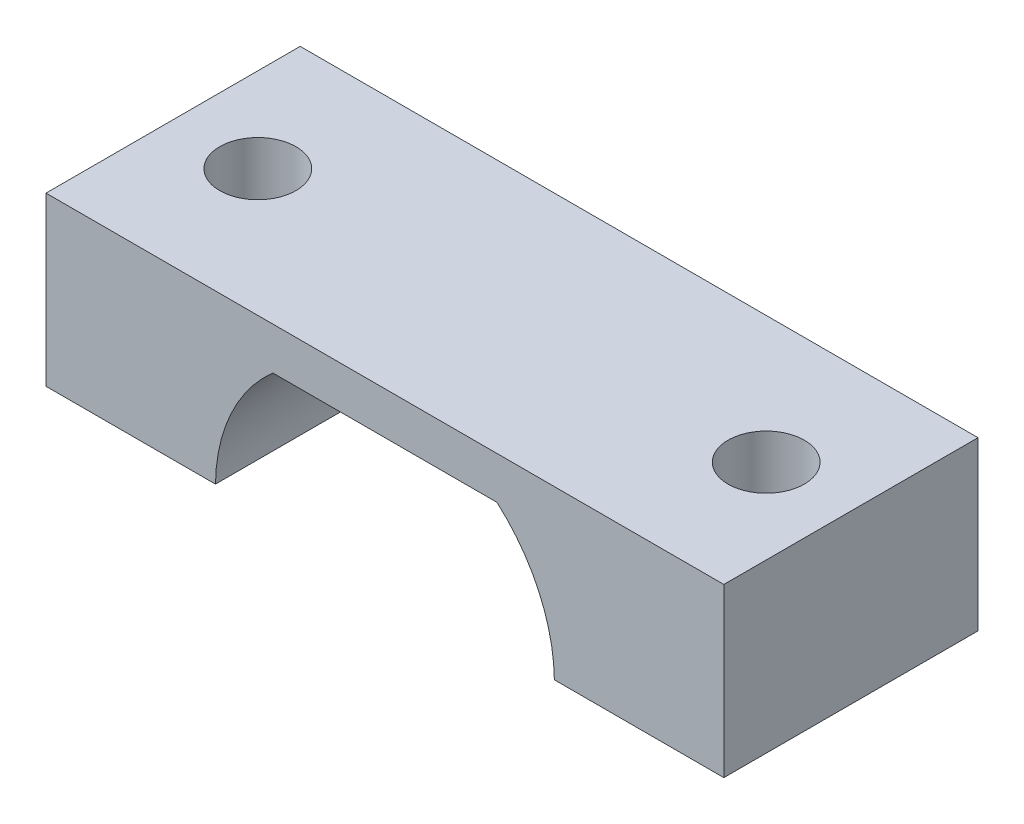
from build123d import *

# Parameters (mm, degrees)
MOTOR_CLAMP_OUTLINE_SOLID_DEPTH     = 7.5
MOTOR_CLAMP_MOUNTING_HOLES_SKETCH_R = 2.25
MOTOR_CLAMP_MOUNTING_HOLE_CUT_DEPTH = 24.532225245


with BuildPart() as part:
    # Motor Clamp Outline Sketch → Motor Clamp Outline Solid (new, symmetric)
    with BuildSketch(Plane.XY):
        with BuildLine():
            Line((-20, 0.125), (-9.999218719, 0.125))
            ThreePointArc((-9.999218719, 0.125), (-9.088484887, 4.171263892), (-6.614378278, 7.5))
            Line((-6.614378278, 7.5), (6.614378278, 7.5))
            ThreePointArc((6.614378278, 7.5), (9.088484887, 4.171263892), (9.999218719, 0.125))
            Line((9.999218719, 0.125), (20, 0.125))
            Line((20, 0.125), (20, 10))
            Line((20, 10), (-20, 10))
            Line((-20, 10), (-20, 0.125))
        make_face()
    extrude(amount=MOTOR_CLAMP_OUTLINE_SOLID_DEPTH, both=True)

    # Motor Clamp Mounting Holes Sketch → Motor Clamp Mounting Hole Cut (cut, through all)
    with BuildSketch(Plane(origin=(0, 10, 0), x_dir=(1, 0, 0), z_dir=(0, 1, 0))):
        with Locations(Location((-15, 0, 0), (0, 0, 270))):
            Circle(MOTOR_CLAMP_MOUNTING_HOLES_SKETCH_R)
        with Locations(Location((15, 0, 0), (0, 0, 270))):
            Circle(MOTOR_CLAMP_MOUNTING_HOLES_SKETCH_R)
    extrude(amount=-MOTOR_CLAMP_MOUNTING_HOLE_CUT_DEPTH, mode=Mode.SUBTRACT)


solid = part.part
